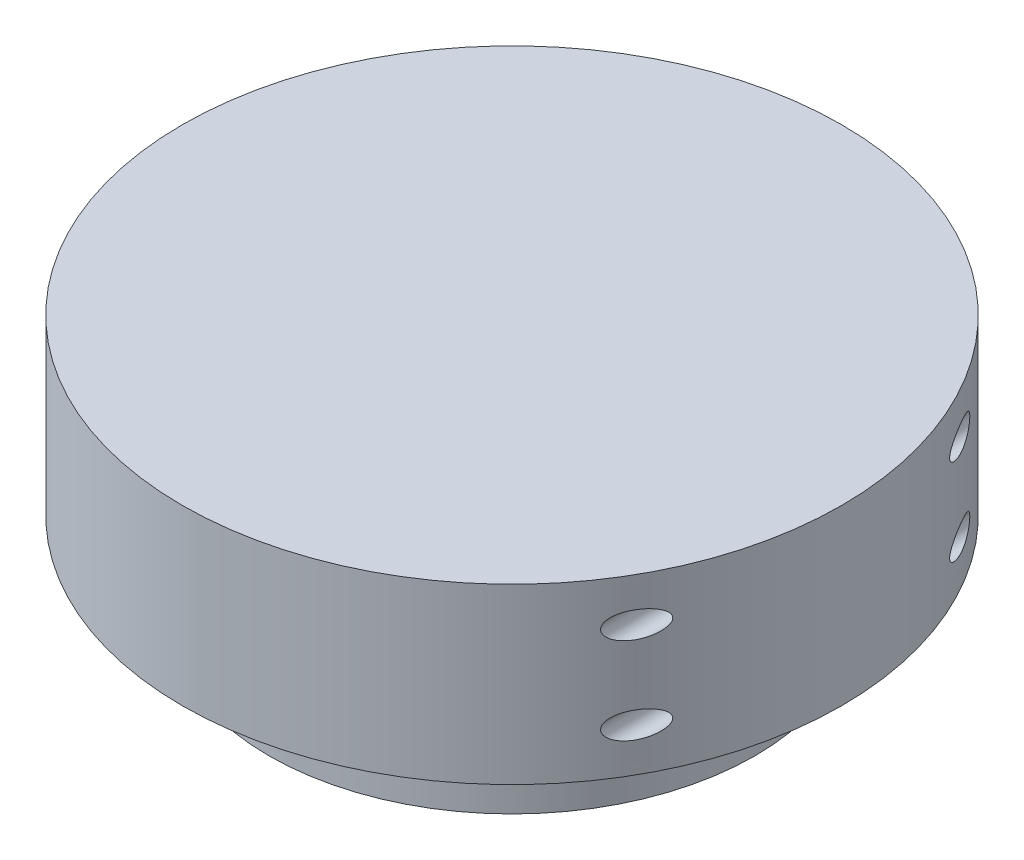
from build123d import *

# Parameters (mm, degrees)
SKETCH1_R               = 38
BOSS_EXTRUDE1_DEPTH     = 20
SKETCH2_R               = 28
SKETCH2_R_2             = 22.5
BOSS_EXTRUDE2_DEPTH     = 10
CUT_EXTRUDE1_DEPTH      = 58.341084747
CUT_EXTRUDE1_DEPTH_BACK = 58.341084747
SKETCH3_R               = 1.5


with BuildPart() as part:
    # Sketch1 → Boss-Extrude1 (new body)
    with BuildSketch(Plane(origin=(0, 0, 0), x_dir=(1, 0, 0), z_dir=(0, 1, 0))):
        with Locations(Location((0, 0, 0), (0, 0, 270))):
            Circle(SKETCH1_R)
    extrude(amount=BOSS_EXTRUDE1_DEPTH)

    # Sketch2 → Boss-Extrude2 (add)
    with BuildSketch(Plane.XZ):
        with Locations(Location((0, 0, 0), (0, 0, 90))):
            Circle(SKETCH2_R)
        with Locations(Location((0, 0, 0), (0, 0, 270))):
            Circle(SKETCH2_R_2, mode=Mode.SUBTRACT)
    extrude(amount=BOSS_EXTRUDE2_DEPTH)

    # Sketch3 → Cut-Extrude1 (cut, two sides: drawn at the far end of the back side and taken through both)
    with BuildSketch(Plane.XY.offset(-CUT_EXTRUDE1_DEPTH_BACK)):
        with Locations((32.986839826, 5)):
            Circle(SKETCH3_R)
        with Locations((32.986839826, 15)):
            Circle(SKETCH3_R)
        with Locations((-32.986839826, 5)):
            Circle(SKETCH3_R)
        with Locations((-32.986839826, 15)):
            Circle(SKETCH3_R)
    extrude(amount=CUT_EXTRUDE1_DEPTH + CUT_EXTRUDE1_DEPTH_BACK, mode=Mode.SUBTRACT)


solid = part.part
